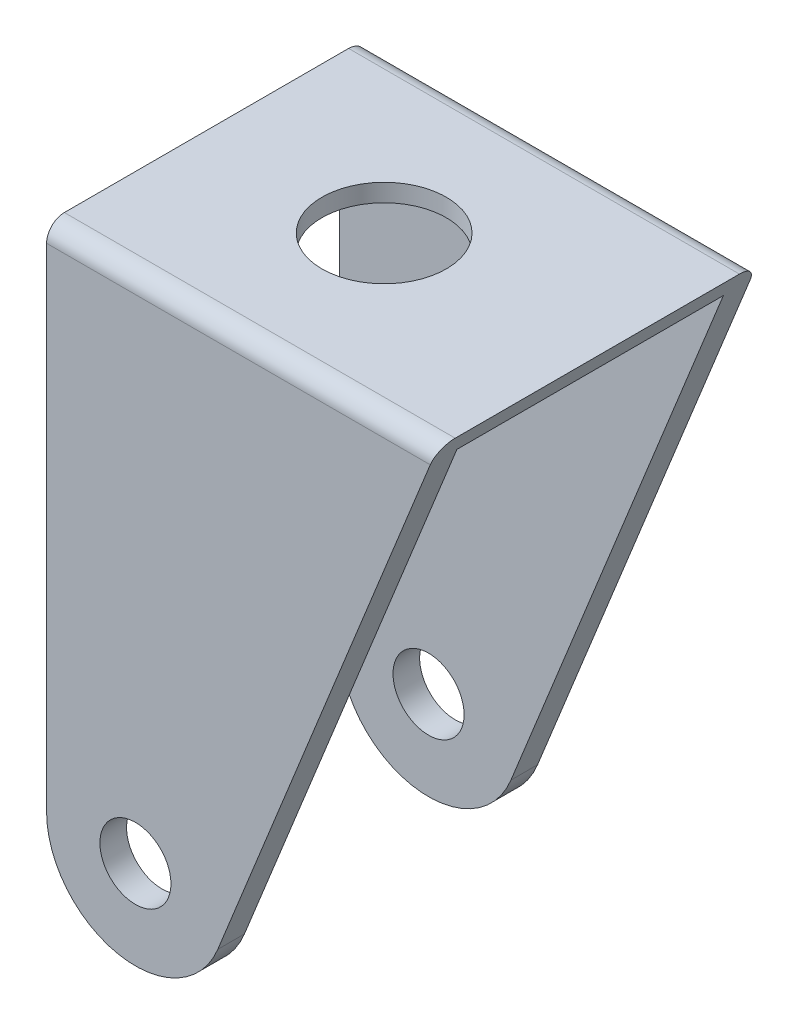
from build123d import *

# Parameters (mm, degrees)
SKETCH_1_R              = 4
EXTRUDE_1_DEPTH         = 18
CUT_EXTRUDE_1_DEPTH     = 15
HOLE_WIZARD_14_0_14_1_D = 14
FILLET_1_R              = 2


with BuildPart() as part:
    # 草图1 → 凸台-拉伸1 (new, symmetric)
    with BuildSketch(Plane.XY):
        with BuildLine():
            Line((-22, 34.943115606), (22, 34.943115606))
            Line((22, 34.943115606), (-2.728161454, -26.261231719))
            ThreePointArc((-2.728161454, -26.261231719), (-13.908089954, -32.331437619), (-22, -22.515165785))
            Line((-22, -22.515165785), (-22, 34.943115606))
        make_face()
        with Locations((-12, -22.515165785)):
            Circle(SKETCH_1_R, mode=Mode.SUBTRACT)
    extrude(amount=EXTRUDE_1_DEPTH, both=True)

    # 草图2 → 切除-拉伸1 (cut, symmetric)
    with BuildSketch(Plane.XY):
        with BuildLine():
            Line((-22, 32.943115606), (21.191947548, 32.943115606))
            Line((21.191947548, 32.943115606), (-2.728161454, -26.261231719))
            ThreePointArc((-2.728161454, -26.261231719), (-13.908089954, -32.331437619), (-22, -22.515165785))
            Line((-22, -22.515165785), (-22, 32.943115606))
        make_face()
    extrude(amount=CUT_EXTRUDE_1_DEPTH, both=True, mode=Mode.SUBTRACT)

    # Ø14.0 (14) 直径孔1 (through all)
    with Locations(Plane(origin=(0, 34.943115606, 0), x_dir=(1, 0, 0), z_dir=(0, 1, 0))):
        with Locations((-2, 0)):
            Hole(HOLE_WIZARD_14_0_14_1_D / 2)

    # 圆角1
    fillet_1_edges = [part.edges().sort_by_distance(p)[0] for p in [
        (0, 34.943115606, 18),
        (0, 34.943115606, -18),
    ]]
    fillet(fillet_1_edges, radius=FILLET_1_R)


solid = part.part
